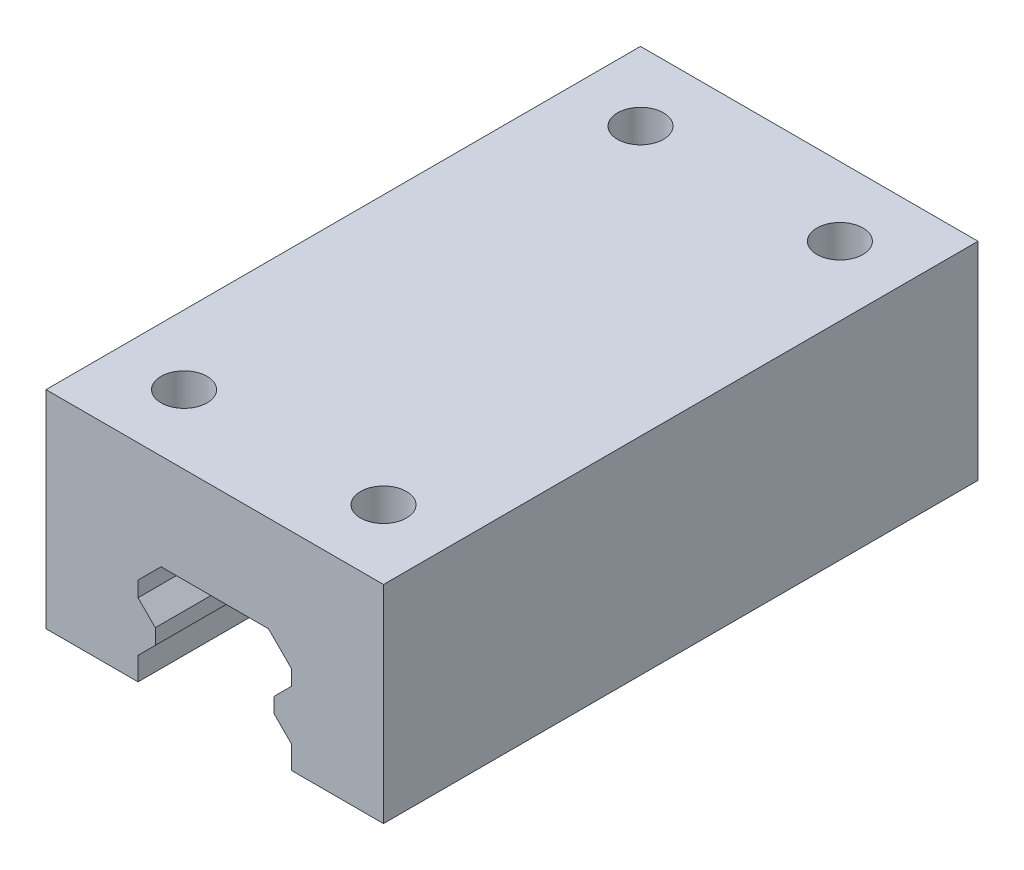
from build123d import *

# Parameters (mm, degrees)
BOSS_EXTRUDE1_DEPTH = 77.5
SKETCH2_R           = 3
CUT_EXTRUDE1_DEPTH  = 10


with BuildPart() as part:
    # Sketch1 → Boss-Extrude1 (new body)
    with BuildSketch(Plane.XY):
        Polygon((0, 32.334319527), (0, 19.834319527), (7, 19.834319527), (10, 16.834319527), (10, 14.834319527), (7.75, 12.584319527), (7.75, 10.584319527), (10, 8.334319527), (10, 5.334319527), (22, 5.334319527), (22, 32.334319527), align=None)
        Polygon((-7, 19.834319527), (0, 19.834319527), (0, 32.334319527), (-22, 32.334319527), (-22, 5.334319527), (-10, 5.334319527), (-10, 8.334319527), (-7.75, 10.584319527), (-7.75, 12.584319527), (-10, 14.834319527), (-10, 16.834319527), align=None)
    extrude(amount=-BOSS_EXTRUDE1_DEPTH)

    # Sketch2 → Cut-Extrude1 (cut)
    with BuildSketch(Plane(origin=(0, 32.334319527, 0), x_dir=(1, 0, 0), z_dir=(0, 1, 0))):
        with Locations(Location((-13, 9, 0), (0, 0, 270))):
            Circle(SKETCH2_R)
        with Locations(Location((-13, 68.5, 0), (0, 0, 270))):
            Circle(SKETCH2_R)
        with Locations(Location((13, 68.5, 0), (0, 0, 90))):
            Circle(SKETCH2_R)
        with Locations(Location((13, 9, 0), (0, 0, 90))):
            Circle(SKETCH2_R)
    extrude(amount=-CUT_EXTRUDE1_DEPTH, mode=Mode.SUBTRACT)


solid = part.part
